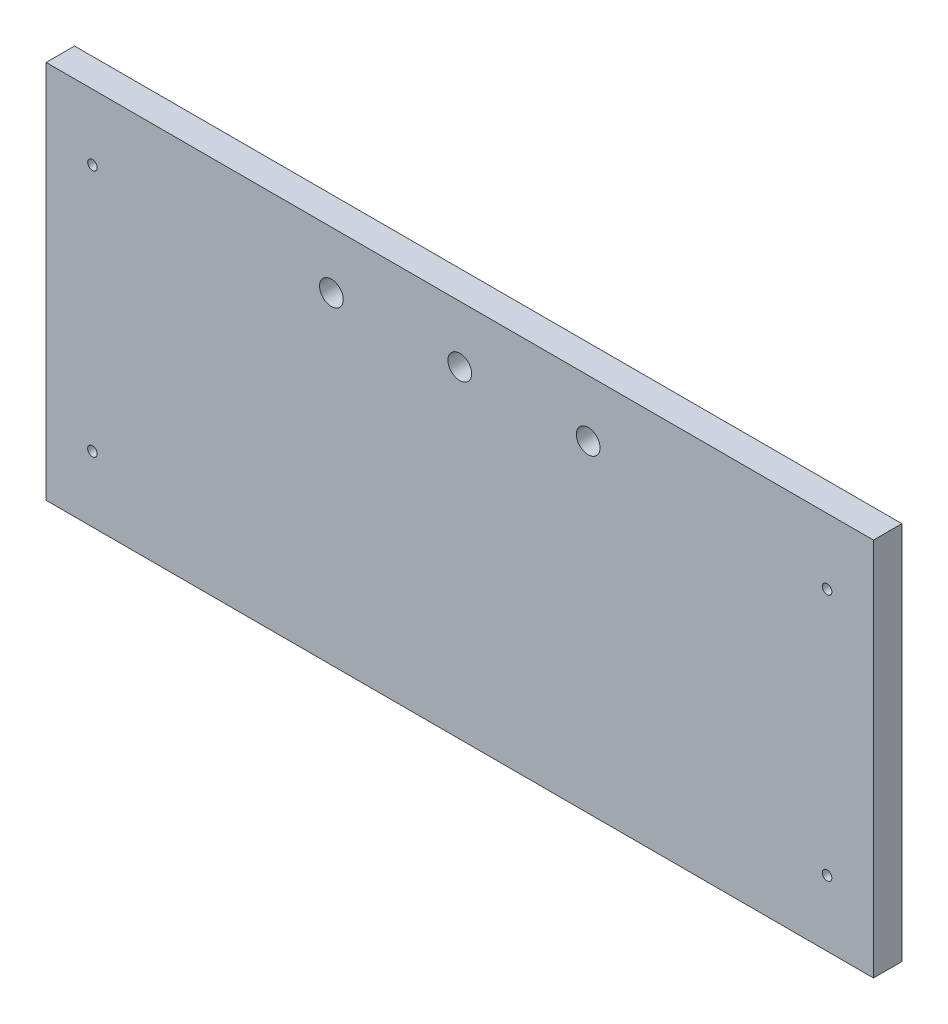
from build123d import *

# Parameters (mm, degrees)
SKETCH1_W           = 277.05
SKETCH1_H           = 127
SKETCH1_R           = 3.96875
SKETCH1_R_2         = 1.6
BOSS_EXTRUDE1_DEPTH = 9.525


with BuildPart() as part:
    # Sketch1 → Boss-Extrude1 (new body)
    with BuildSketch(Plane.XY):
        with Locations((138.525, 63.5)):
            Rectangle(SKETCH1_W, SKETCH1_H)
        with Locations(Location((95.525, 107.95, 0), (0, 0, 180))):
            Circle(SKETCH1_R, mode=Mode.SUBTRACT)
        with Locations(Location((138.525, 107.95, 0), (0, 0, 180))):
            Circle(SKETCH1_R, mode=Mode.SUBTRACT)
        with Locations(Location((181.525, 107.95, 0), (0, 0, 180))):
            Circle(SKETCH1_R, mode=Mode.SUBTRACT)
        with Locations(Location((15.525, 105, 0), (0, 0, 180))):
            Circle(SKETCH1_R_2, mode=Mode.SUBTRACT)
        with Locations(Location((15.525, 22, 0), (0, 0, 180))):
            Circle(SKETCH1_R_2, mode=Mode.SUBTRACT)
        with Locations(Location((261.525, 105, 0), (0, 0, 180))):
            Circle(SKETCH1_R_2, mode=Mode.SUBTRACT)
        with Locations(Location((261.525, 22, 0), (0, 0, 180))):
            Circle(SKETCH1_R_2, mode=Mode.SUBTRACT)
    extrude(amount=BOSS_EXTRUDE1_DEPTH)


solid = part.part
